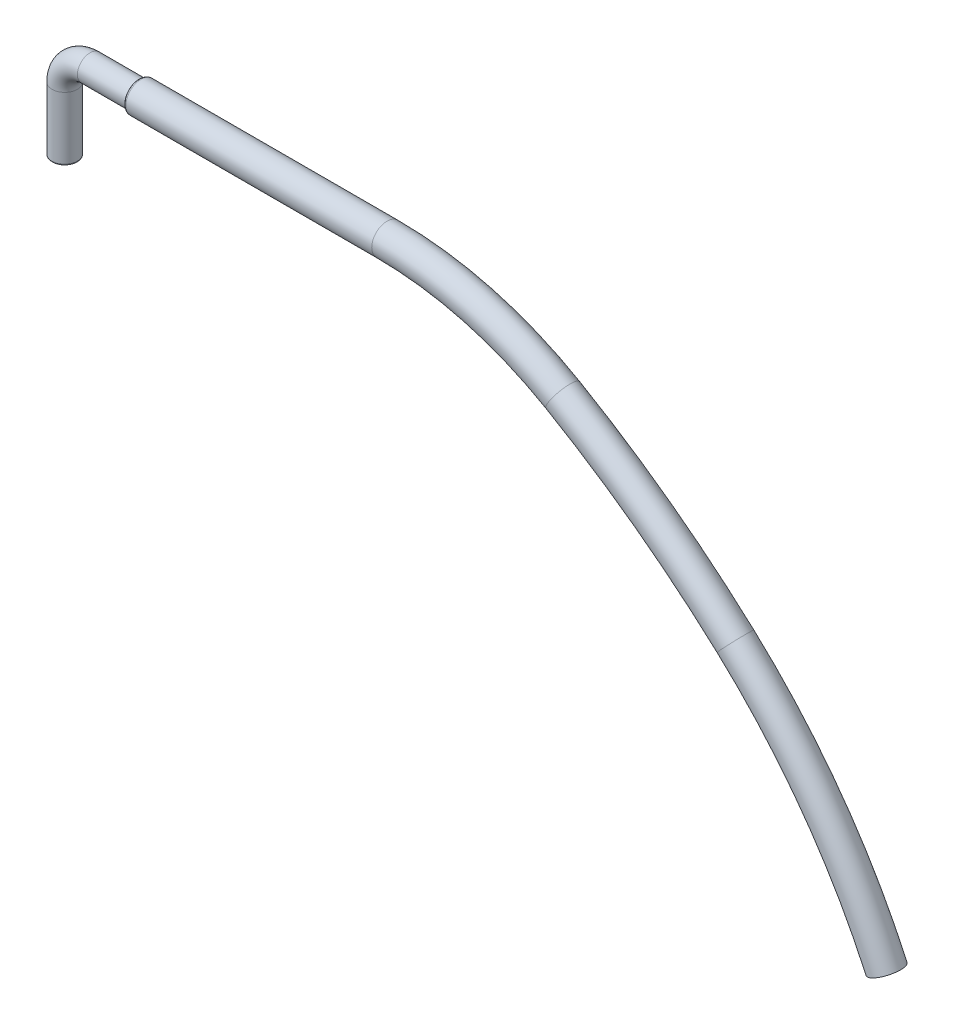
from build123d import *

# Parameters (mm, degrees)
CROQUIS2_R  = 5
VACIADO2_T  = -2
REDONDEO1_R = 0.5
CROQUIS7_R  = 6
VACIADO3_T  = -4
REDONDEO2_R = 1


with BuildPart() as part:
    # Barrer1: sweep along a path in Croquis1
    with BuildLine(Plane.XY) as barrer1_path:
        Line((0, -35), (0, -10))
        ThreePointArc((0, -10), (2.928932188, -2.928932188), (10, 0))
        Line((10, 0), (50, 0))
    # Croquis2 → Barrer1 (sweep)
    with BuildSketch(Plane.XZ.offset(35)):
        Circle(CROQUIS2_R)
    sweep(path=barrer1_path.line)

    # Vaciado2
    vaciado2_openings = [part.faces().sort_by_distance(p)[0] for p in [
        (50, 0, 0),
        (0, -35, 0),
    ]]
    offset(amount=VACIADO2_T, openings=vaciado2_openings, kind=Kind.INTERSECTION)

    # Redondeo1
    redondeo1_edges = [part.edges().sort_by_distance(p)[0] for p in [
        (-5, -35, 0),
        (50, 5, 0),
        (50, 3, 0),
        (-3, -35, 0),
    ]]
    fillet(redondeo1_edges, radius=REDONDEO1_R)


with BuildPart() as body_2:
    # Barrer2: sweep along a path in Croquis6
    with BuildLine(Plane.XY) as barrer2_path:
        Line((29.094637827, 0), (126.948403012, 0))
        ThreePointArc((126.948403012, 0), (162.772004772, -4.730522037), (196.139760018, -18.597792557))
        ThreePointArc((196.139760018, -18.597792557), (231.558429747, -41.779192076), (264.252312027, -68.667284431))
        ThreePointArc((264.252312027, -68.667284431), (298.15596806, -106.717970969), (323.794410472, -150.763208045))
    # Croquis7 → Barrer2 (sweep)
    with BuildSketch(Plane(origin=(29.094637827, 0, 0), x_dir=(0, 0, -1), z_dir=(1, 0, 0))):
        Circle(CROQUIS7_R)
    sweep(path=barrer2_path.line)

    # Vaciado3
    vaciado3_openings = [body_2.faces().sort_by_distance(p)[0] for p in [
        (323.794410472, -150.763208045, 0),
        (29.094637827, 0, 0),
    ]]
    offset(amount=VACIADO3_T, openings=vaciado3_openings, kind=Kind.INTERSECTION)

    # Redondeo2
    redondeo2_edges = [body_2.edges().sort_by_distance(p)[0] for p in [
        (29.094637827, 0, 6),
    ]]
    fillet(redondeo2_edges, radius=REDONDEO2_R)


solid = Compound([part.part, body_2.part])
